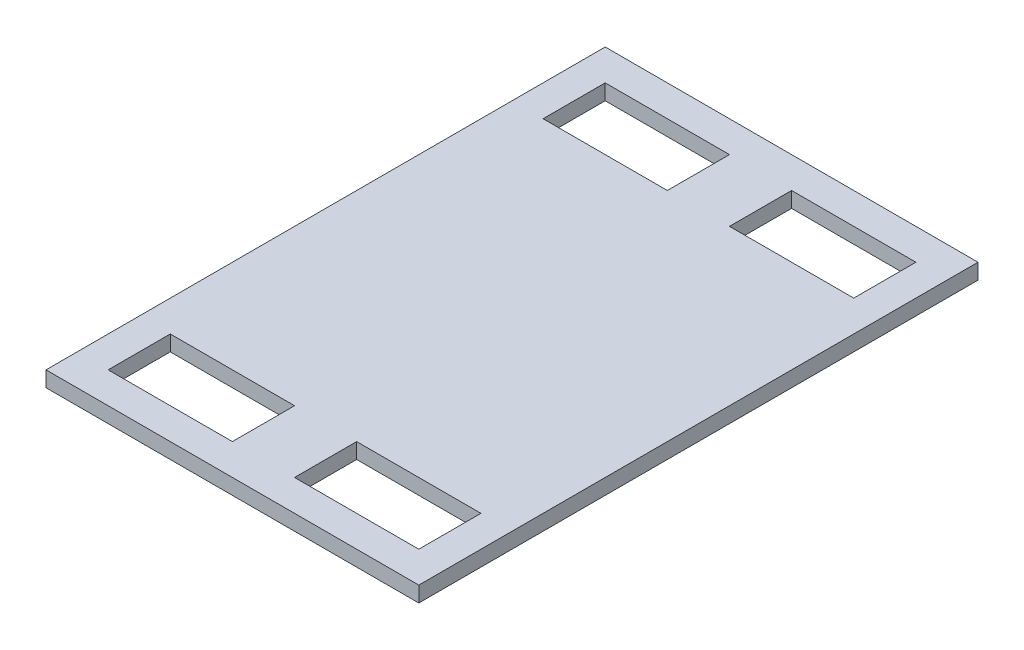
from build123d import *

# Parameters (mm, degrees)
SKETCH1_W               = 120
SKETCH1_H               = 180
BOSS_EXTRUDE1_DEPTH     = 5
SKETCH3_W               = 40
SKETCH3_H               = 20
CUT_EXTRUDE2_DEPTH      = 5
MIRROR2_COPY_1_SKETCH_W = 40
MIRROR2_COPY_1_SKETCH_H = 20
MIRROR2_COPY_1_DEPTH    = 5


with BuildPart() as part:
    # Sketch1 → Boss-Extrude1 (new body)
    with BuildSketch(Plane(origin=(0, 0, 0), x_dir=(1, 0, 0), z_dir=(0, 1, 0))):
        with Locations((60, 90)):
            Rectangle(SKETCH1_W, SKETCH1_H)
    extrude(amount=BOSS_EXTRUDE1_DEPTH)

    # Sketch3 → Cut-Extrude2 (cut)
    with BuildSketch(Plane.XZ):
        with Locations((30, -160)):
            Rectangle(SKETCH3_W, SKETCH3_H)
    cut_extrude2 = extrude(amount=-CUT_EXTRUDE2_DEPTH, mode=Mode.SUBTRACT)

    # Mirror1: Cut-Extrude2 across plane
    add(cut_extrude2.mirror(Plane.ZY.offset(-60)), mode=Mode.SUBTRACT)

    # Mirror2: Cut-Extrude2 across plane
    add(cut_extrude2.mirror(Plane(origin=(0, 0, -90), x_dir=(1, 0, 0), z_dir=(0, 0, -1))), mode=Mode.SUBTRACT)

    # Mirror2 copy 1 sketch → Mirror2 copy 1 (cut)
    with BuildSketch(Plane(origin=(120, 0, -180), x_dir=(-1, 0, 0), z_dir=(0, -1, 0))):
        with Locations((30, -160)):
            Rectangle(MIRROR2_COPY_1_SKETCH_W, MIRROR2_COPY_1_SKETCH_H)
    extrude(amount=-MIRROR2_COPY_1_DEPTH, mode=Mode.SUBTRACT)


solid = part.part
